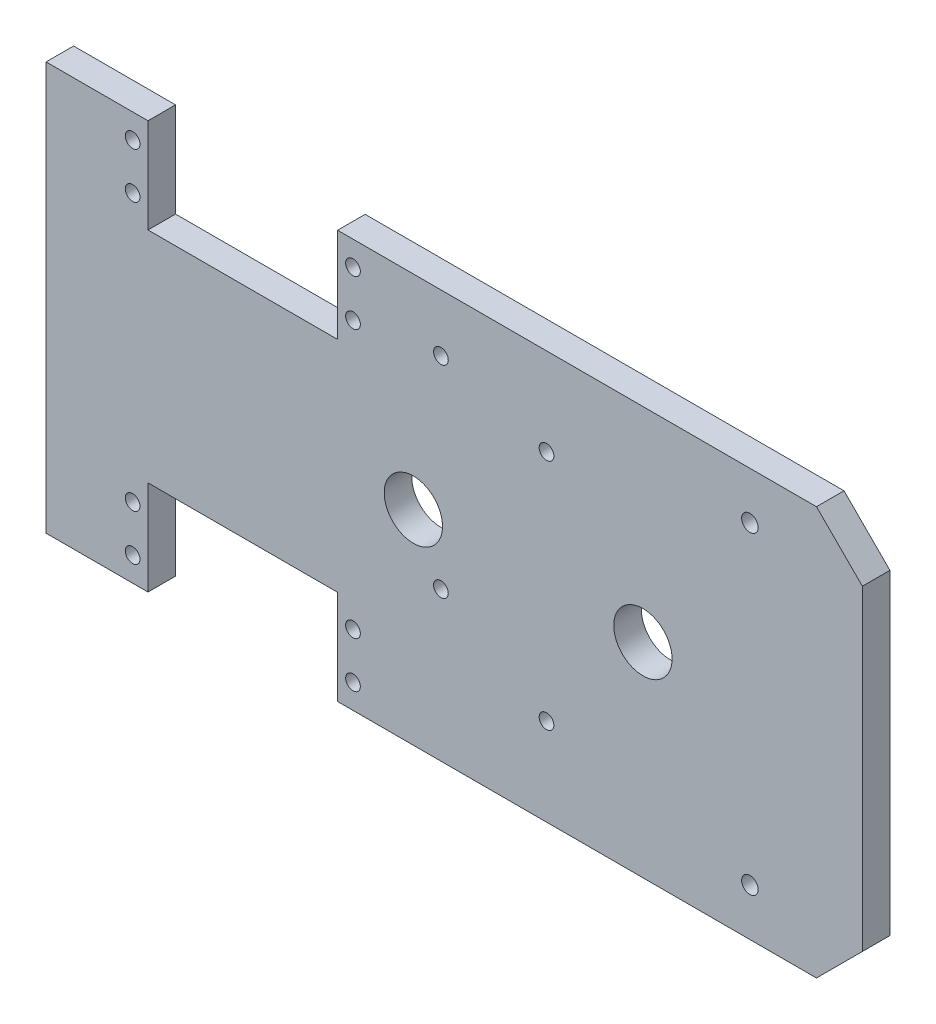
from build123d import *

# Parameters (mm, degrees)
SKETCH1_R           = 1.6
SKETCH1_R_2         = 1.8
SKETCH1_R_3         = 6.35
BOSS_EXTRUDE1_DEPTH = 6


with BuildPart() as part:
    # Sketch1 → Boss-Extrude1 (new body)
    with BuildSketch(Plane.XY):
        Polygon((0, -44.45), (22.2, -44.45), (22.2, -23.85), (63.5, -23.85), (63.5, -44.45), (167.8, -44.45), (177.8, -34.45), (177.8, 34.45), (167.8, 44.45), (63.5, 44.45), (63.5, 23.85), (22.2, 23.85), (22.2, 44.45), (0, 44.45), align=None)
        with Locations((18.85, 29.15)):
            Circle(SKETCH1_R, mode=Mode.SUBTRACT)
        with Locations((18.85, 39.15)):
            Circle(SKETCH1_R, mode=Mode.SUBTRACT)
        with Locations((66.85, 29.15)):
            Circle(SKETCH1_R, mode=Mode.SUBTRACT)
        with Locations((66.85, 39.15)):
            Circle(SKETCH1_R, mode=Mode.SUBTRACT)
        with Locations((153.3, 34.15)):
            Circle(SKETCH1_R_2, mode=Mode.SUBTRACT)
        with Locations((109, 25.4)):
            Circle(SKETCH1_R, mode=Mode.SUBTRACT)
        with Locations((18.85, -29.15)):
            Circle(SKETCH1_R, mode=Mode.SUBTRACT)
        with Locations((18.85, -39.15)):
            Circle(SKETCH1_R, mode=Mode.SUBTRACT)
        with Locations((66.85, -29.15)):
            Circle(SKETCH1_R, mode=Mode.SUBTRACT)
        with Locations((66.85, -39.15)):
            Circle(SKETCH1_R, mode=Mode.SUBTRACT)
        with Locations((153.3, -34.15)):
            Circle(SKETCH1_R_2, mode=Mode.SUBTRACT)
        with Locations((109, -25.4)):
            Circle(SKETCH1_R, mode=Mode.SUBTRACT)
        with Locations((86, -12)):
            Circle(SKETCH1_R, mode=Mode.SUBTRACT)
        with Locations((86, 32)):
            Circle(SKETCH1_R, mode=Mode.SUBTRACT)
        with Locations((80, 0)):
            Circle(SKETCH1_R_3, mode=Mode.SUBTRACT)
        with Locations((130, 0)):
            Circle(SKETCH1_R_3, mode=Mode.SUBTRACT)
    extrude(amount=BOSS_EXTRUDE1_DEPTH)


solid = part.part
